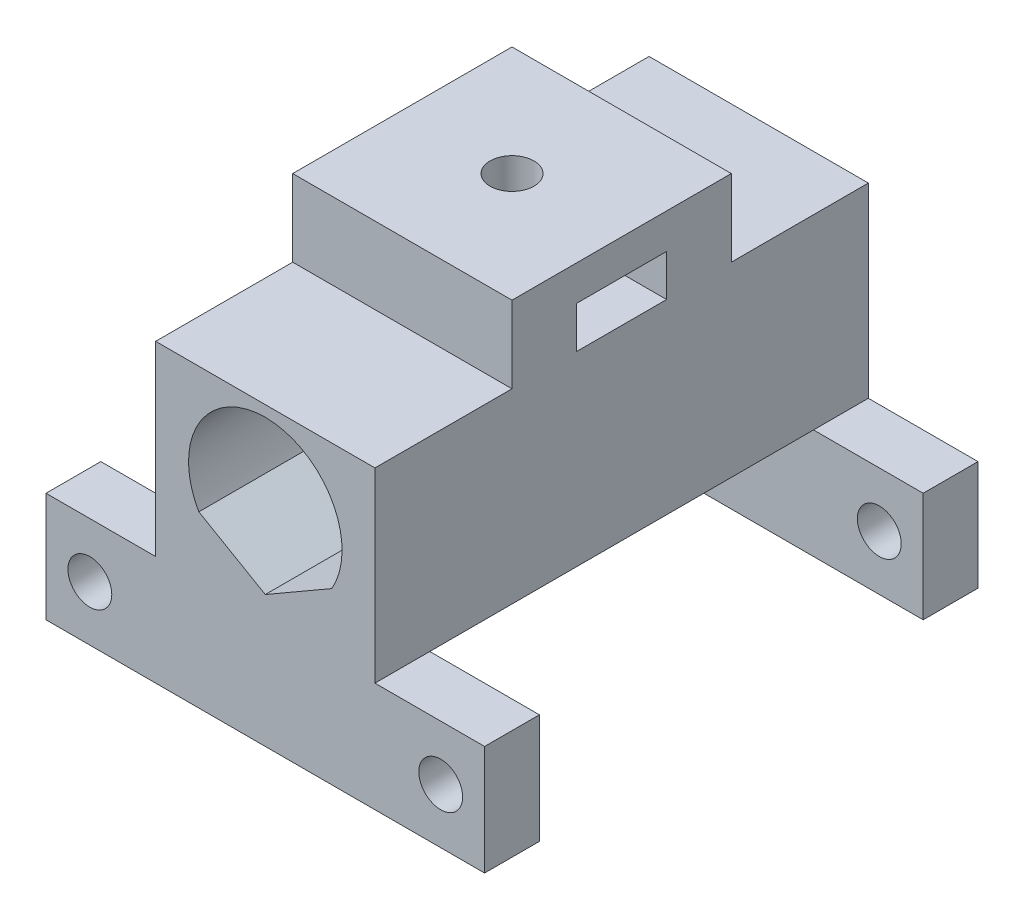
from build123d import *

# Parameters (mm, degrees)
SKETCH1_W           = 20
SKETCH1_H           = 45
BOSS_EXTRUDE1_DEPTH = 17
CUT_EXTRUDE1_DEPTH  = 50.132473986
BOSS_EXTRUDE2_DEPTH = 5
SKETCH4_R           = 2
CUT_EXTRUDE2_DEPTH  = 53.096065111
SKETCH6_W           = 20
SKETCH6_H           = 20
BOSS_EXTRUDE3_DEPTH = 7
SKETCH8_W           = 8.2
SKETCH8_H           = 3.8
CUT_EXTRUDE3_DEPTH  = 45.522466239
CUT_EXTRUDE4_REACH  = 47.412
SKETCH7_R           = 2


with BuildPart() as part:
    # Sketch1 → Boss-Extrude1 (new body)
    with BuildSketch(Plane(origin=(0, 0, 0), x_dir=(1, 0, 0), z_dir=(0, 1, 0))):
        Rectangle(SKETCH1_W, SKETCH1_H)
    extrude(amount=BOSS_EXTRUDE1_DEPTH)

    # Sketch2 → Cut-Extrude1 (cut, through all)
    with BuildSketch(Plane.XY.offset(22.5)):
        with BuildLine():
            Line((0, 2), (-6.062177826, 5.5))
            ThreePointArc((-6.062177826, 5.5), (0, 16), (6.062177826, 5.5))
            Line((6.062177826, 5.5), (0, 2))
        make_face()
    extrude(amount=-CUT_EXTRUDE1_DEPTH, mode=Mode.SUBTRACT)

    # Sketch3 → Boss-Extrude2 (add)
    with BuildSketch(Plane.XY.offset(22.5)):
        Polygon((10, 0), (20, 0), (20, -10), (-20, -10), (-20, 0), (-10, 0), align=None)
    boss_extrude2 = extrude(amount=-BOSS_EXTRUDE2_DEPTH)

    # Mirror1: Boss-Extrude2 across plane
    add(boss_extrude2.mirror(Plane.XY))

    # Sketch4 → Cut-Extrude2 (cut, through all)
    with BuildSketch(Plane.XY.offset(22.5)):
        with Locations((16, -5)):
            Circle(SKETCH4_R)
        with Locations((-16, -5)):
            Circle(SKETCH4_R)
    extrude(amount=-CUT_EXTRUDE2_DEPTH, mode=Mode.SUBTRACT)

    # Sketch6 → Boss-Extrude3 (add)
    with BuildSketch(Plane(origin=(0, 17, 0), x_dir=(1, 0, 0), z_dir=(0, 1, 0))):
        Rectangle(SKETCH6_W, SKETCH6_H)
    extrude(amount=BOSS_EXTRUDE3_DEPTH)

    # Sketch8 → Cut-Extrude3 (cut, through all)
    with BuildSketch(Plane(origin=(10, 0, 0), x_dir=(0, 0, -1), z_dir=(1, 0, 0))):
        with Locations((0, 18.9)):
            Rectangle(SKETCH8_W, SKETCH8_H)
    extrude(amount=-CUT_EXTRUDE3_DEPTH, mode=Mode.SUBTRACT)

    # Sketch7 → Cut-Extrude4 (cut, up to next)
    with BuildSketch(Plane(origin=(0, 24, 0), x_dir=(1, 0, 0), z_dir=(0, 1, 0)), mode=Mode.PRIVATE) as cut_extrude4_sk1:
        with Locations(Location((0, 0, 0), (0, 0, 270))):
            Circle(SKETCH7_R)
    cut_extrude4_tool1 = extrude(cut_extrude4_sk1.sketch, amount=-CUT_EXTRUDE4_REACH, mode=Mode.PRIVATE) & part.part
    add(cut_extrude4_tool1.solids().sort_by_distance((0, 24, 0))[0], mode=Mode.SUBTRACT)


solid = part.part
